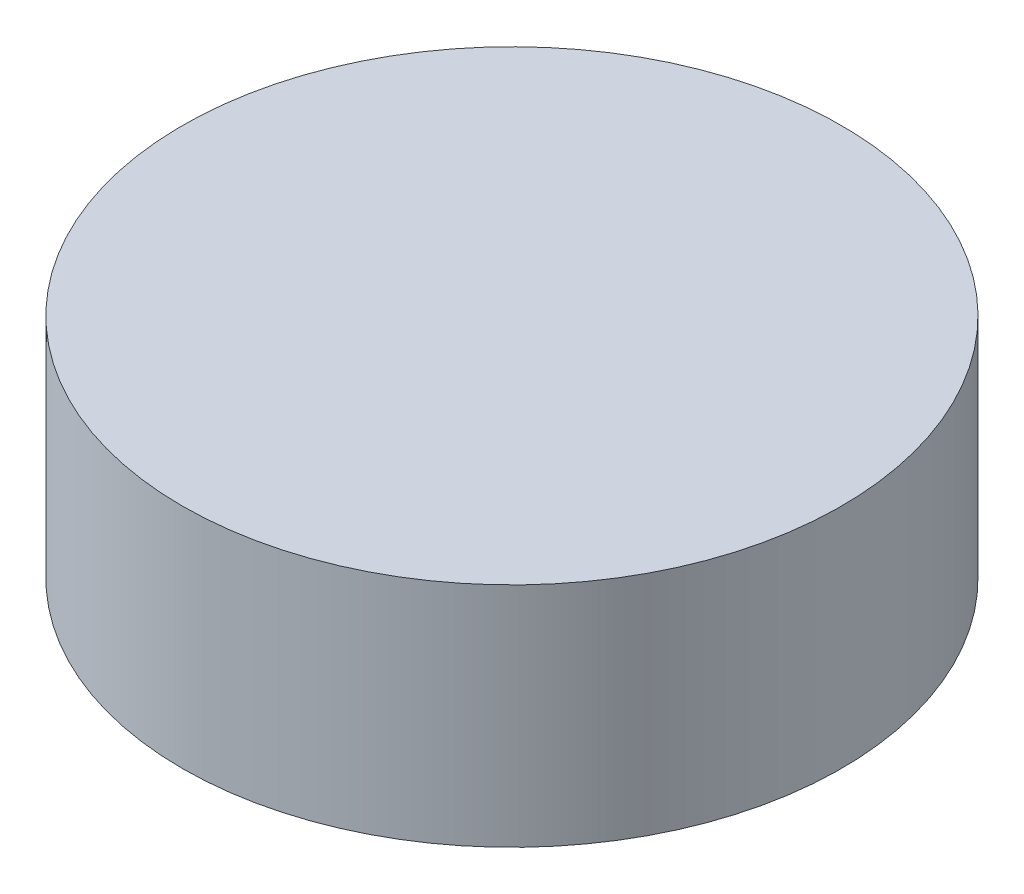
from build123d import *

# Parameters (mm, degrees)
SKETCH_1_R      = 7.25
EXTRUDE_1_DEPTH = 5


with BuildPart() as part:
    # Эскиз1 → Бобышка-Вытянуть1 (new body)
    with BuildSketch(Plane(origin=(0, 0, 0), x_dir=(1, 0, 0), z_dir=(0, 1, 0))):
        with Locations(Location((0, 0, 0), (0, 0, 270))):
            Circle(SKETCH_1_R)
    extrude(amount=EXTRUDE_1_DEPTH)


solid = part.part
